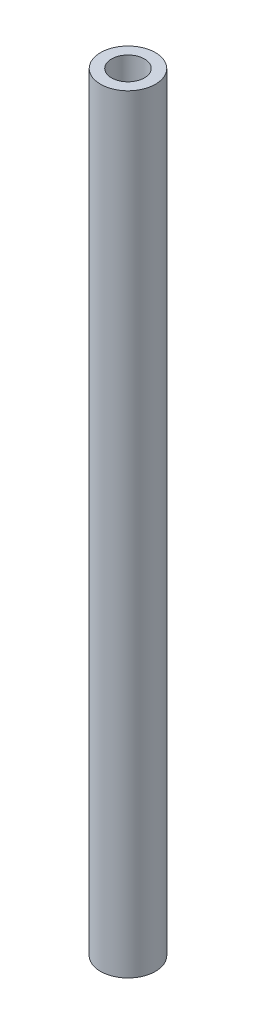
from build123d import *

# Parameters (mm, degrees)
SKETCH_1_R      = 2.5
SKETCH_1_R_2    = 1.5
EXTRUDE_1_DEPTH = 70


with BuildPart() as part:
    # 草图1 → 凸台-拉伸1 (new body)
    with BuildSketch(Plane(origin=(0, 0, 0), x_dir=(1, 0, 0), z_dir=(0, 1, 0))):
        with Locations(Location((0, 0, 0), (0, 0, 270))):
            Circle(SKETCH_1_R)
        with Locations(Location((0, 0, 0), (0, 0, 270))):
            Circle(SKETCH_1_R_2, mode=Mode.SUBTRACT)
    extrude(amount=EXTRUDE_1_DEPTH)


solid = part.part
